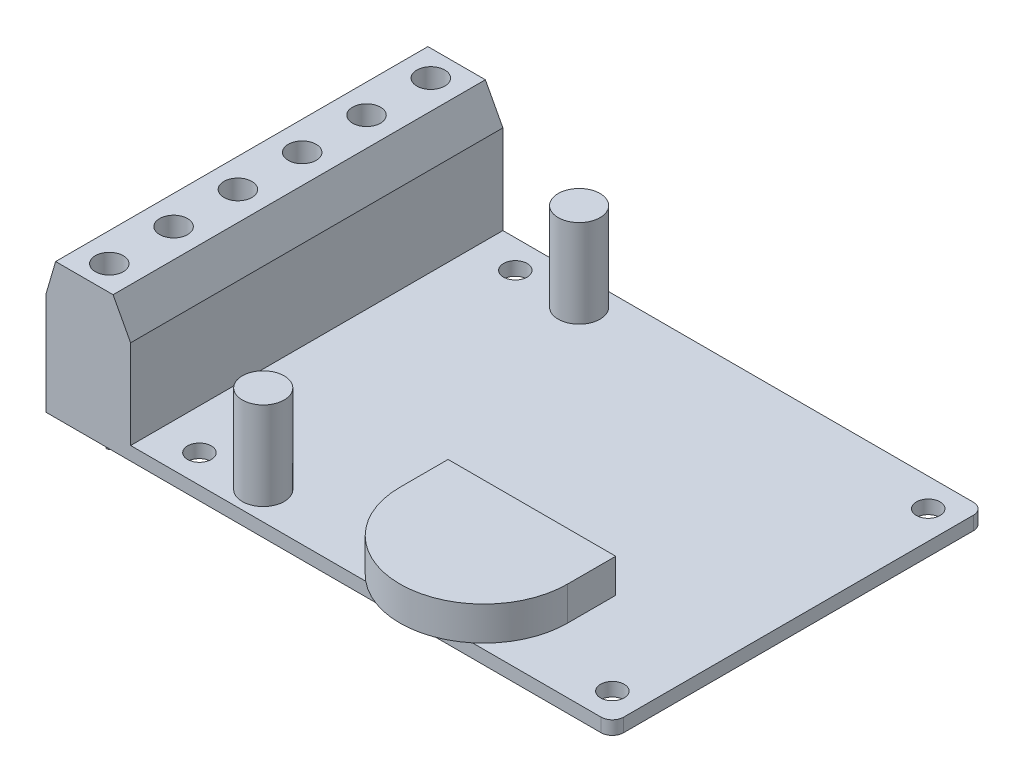
from build123d import *

# Parameters (mm, degrees)
EXTRUDE_1_DEPTH     = 1.2
EXTRUDE_3_DEPTH     = 33
SKETCH_4_R          = 1.237994263
CUT_EXTRUDE_1_DEPTH = 2
SKETCH_5_R          = 1.05
CUT_EXTRUDE_2_DEPTH = 2
SKETCH_6_R          = 0.435075244
EXTRUDE_4_DEPTH     = 0.1
SKETCH_7_R          = 0.221451087
EXTRUDE_5_DEPTH     = 2
SKETCH_8_W          = 0.314102564
SKETCH_8_H          = 2.557692308
EXTRUDE_6_DEPTH     = 0.01
SKETCH_10_R         = 1.85458941
EXTRUDE_7_DEPTH     = 7.8
EXTRUDE_8_DEPTH     = 3


with BuildPart() as part:
    # 草图2 → 凸台-拉伸1 (new body)
    with BuildSketch(Plane(origin=(0, 0, 0), x_dir=(1, 0, 0), z_dir=(0, 1, 0))):
        with BuildLine():
            Line((1, 0), (49.2, 0))
            ThreePointArc((49.2, 0), (49.907106781, -0.292893219), (50.2, -1))
            Line((50.2, -1), (50.2, -32))
            ThreePointArc((50.2, -32), (49.907106781, -32.707106781), (49.2, -33))
            Line((49.2, -33), (1, -33))
            ThreePointArc((1, -33), (0.292893219, -32.707106781), (0, -32))
            Line((0, -32), (0, -1))
            ThreePointArc((0, -1), (0.292893219, -0.292893219), (1, 0))
        make_face()
    extrude(amount=EXTRUDE_1_DEPTH)

    # 草图5 → 切除-拉伸2 (cut)
    with BuildSketch(Plane(origin=(0, 1.2, 0), x_dir=(1, 0, 0), z_dir=(0, 1, 0))):
        with Locations(Location((47.7, -2.5, 0), (0, 0, 270))):
            Circle(SKETCH_5_R)
        with Locations(Location((47.7, -30.5, 0), (0, 0, 270))):
            Circle(SKETCH_5_R)
        with Locations(Location((11.1, -2.5, 0), (0, 0, 270))):
            Circle(SKETCH_5_R)
        with Locations(Location((11.1, -30.5, 0), (0, 0, 270))):
            Circle(SKETCH_5_R)
    extrude(amount=-CUT_EXTRUDE_2_DEPTH, mode=Mode.SUBTRACT)



with BuildPart() as body_2:
    # 草图3 → 凸台-拉伸3 (new body)
    with BuildSketch(Plane.XY):
        Polygon((0, 0), (0, 9.08434782), (0.851677453, 12), (5.945874068, 12), (7.5, 9.08434782), (7.5, 0), align=None)
    extrude(amount=EXTRUDE_3_DEPTH)

    # 草图4 → 切除-拉伸1 (cut)
    with BuildSketch(Plane(origin=(0, 12, 0), x_dir=(1, 0, 0), z_dir=(0, 1, 0))):
        with Locations(Location((3.39877576, -2.288422337, 0), (0, 0, 270))):
            Circle(SKETCH_4_R)
        with Locations(Location((3.39877576, -7.988422337, 0), (0, 0, 270))):
            Circle(SKETCH_4_R)
        with Locations(Location((3.39877576, -13.688422337, 0), (0, 0, 270))):
            Circle(SKETCH_4_R)
        with Locations(Location((3.39877576, -19.388422337, 0), (0, 0, 270))):
            Circle(SKETCH_4_R)
        with Locations(Location((3.39877576, -25.088422337, 0), (0, 0, 270))):
            Circle(SKETCH_4_R)
        with Locations(Location((3.39877576, -30.788422337, 0), (0, 0, 270))):
            Circle(SKETCH_4_R)
    extrude(amount=-CUT_EXTRUDE_1_DEPTH, mode=Mode.SUBTRACT)


with BuildPart() as part_1:
    add(part.part)

    add(body_2.part)  # 凸台-拉伸4 merges body 2
    # 草图6 → 凸台-拉伸4 (add)
    with BuildSketch(Plane.XZ):
        with Locations(Location((3.39877576, 25.088422337, 0), (0, 0, 90))):
            Circle(SKETCH_6_R)
        with Locations(Location((3.39877576, 19.388422337, 0), (0, 0, 90))):
            Circle(SKETCH_6_R)
        with Locations(Location((3.39877576, 13.688422337, 0), (0, 0, 90))):
            Circle(SKETCH_6_R)
        with Locations(Location((3.39877576, 7.988422337, 0), (0, 0, 90))):
            Circle(SKETCH_6_R)
        with Locations(Location((3.39877576, 2.288422337, 0), (0, 0, 90))):
            Circle(SKETCH_6_R)
        with Locations(Location((3.39877576, 30.788422337, 0), (0, 0, 90))):
            Circle(SKETCH_6_R)
    extrude(amount=EXTRUDE_4_DEPTH)

    # 草图7 → 凸台-拉伸5 (add)
    with BuildSketch(Plane.XZ.offset(0.1)):
        with Locations(Location((3.39877576, 30.788422337, 0), (0, 0, 270))):
            Circle(SKETCH_7_R)
        with Locations(Location((3.39877576, 25.088422337, 0), (0, 0, 270))):
            Circle(SKETCH_7_R)
        with Locations(Location((3.39877576, 19.388422337, 0), (0, 0, 270))):
            Circle(SKETCH_7_R)
        with Locations(Location((3.39877576, 13.688422337, 0), (0, 0, 270))):
            Circle(SKETCH_7_R)
        with Locations(Location((3.39877576, 7.988422337, 0), (0, 0, 270))):
            Circle(SKETCH_7_R)
        with Locations(Location((3.39877576, 2.288422337, 0), (0, 0, 270))):
            Circle(SKETCH_7_R)
    extrude(amount=EXTRUDE_5_DEPTH)

    # 草图8 → 凸台-拉伸6 (add)
    # profile 1 of 6: a face of its own
    with BuildSketch(Plane.XZ):
        with BuildLine():
            Line((18.513026826, 20), (19.213447499, 20))
            add(Edge.make_bspline(
                [(19.213447499, 20), (19.260188628, 19.999844414), (19.349936772, 19.999545672), (19.478510043, 19.997879909), (19.59533714, 19.993105553), (19.700356979, 19.98899697), (19.793567634, 19.981505028), (19.875254925, 19.974344381), (19.945042622, 19.96497072), (19.987288473, 19.956265297), (20.006416249, 19.952323718)],
                knots=[0, 0, 0, 0, 1.410062039, 2.707475311, 3.878576406, 4.937260626, 5.877586885, 6.699081471, 7.410979367, 8, 8, 8, 8], degree=3))
            add(Edge.make_bspline(
                [(20.006416249, 19.952323718), (20.032022873, 19.945996953), (20.082689863, 19.933478389), (20.155639929, 19.907018788), (20.225154253, 19.876399163), (20.290944077, 19.840435443), (20.352679868, 19.798860663), (20.410998179, 19.752392541), (20.466163643, 19.701285335), (20.515945273, 19.644250494), (20.562884324, 19.584413984), (20.602472951, 19.519710227), (20.636599431, 19.4520487), (20.663769948, 19.380741282), (20.685647921, 19.30647951), (20.701074161, 19.228590713), (20.710325348, 19.147429738), (20.711267204, 19.09207183), (20.711744775, 19.064002404)],
                knots=[0, 0, 0, 0, 1.027469482, 2.033020251, 3.019912614, 3.986113645, 4.951240523, 5.91722682, 6.890402269, 7.87763091, 8.8651537, 9.85103654, 10.82876324, 11.815024772, 12.821070561, 13.842952187, 14.906261191, 16, 16, 16, 16], degree=3))
            add(Edge.make_bspline(
                [(20.711744775, 19.064002404), (20.710275777, 19.017367299), (20.707409381, 18.926370131), (20.680684277, 18.79430925), (20.636907758, 18.671119935), (20.576584469, 18.556957297), (20.499764993, 18.454046652), (20.407440202, 18.363656197), (20.29955859, 18.288016284), (20.199129274, 18.235563479), (20.110415075, 18.201970571), (20.037381762, 18.178334212), (19.957714784, 18.160072247), (19.87217745, 18.143712115), (19.780413794, 18.13136042), (19.682643755, 18.122313826), (19.578797603, 18.116659777), (19.507458534, 18.115817772), (19.470759198, 18.115384615)],
                knots=[0, 0, 0, 0, 1.260483769, 2.459530307, 3.627416485, 4.787058657, 5.939039949, 7.08810263, 8.267026773, 9.491475466, 10.141966685, 10.831826277, 11.566392101, 12.351337768, 13.187381173, 14.07005841, 15.007169909, 16, 16, 16, 16], degree=3))
            Line((19.470759198, 18.115384615), (20.75661657, 16.5))
            Line((20.75661657, 16.5), (20.368195095, 16.5))
            Line((20.368195095, 16.5), (19.082337724, 18.115384615))
            Line((19.082337724, 18.115384615), (18.82712939, 18.115384615))
            Line((18.82712939, 18.115384615), (18.82712939, 16.5))
            Line((18.82712939, 16.5), (18.513026826, 16.5))
            Line((18.513026826, 16.5), (18.513026826, 20))
        make_face()
        with BuildLine():
            Line((18.82712939, 19.641025641), (18.82712939, 18.474358974))
            Line((18.82712939, 18.474358974), (19.467954711, 18.469451122))
            add(Edge.make_bspline(
                [(19.467954711, 18.469451122), (19.49787475, 18.469437885), (19.555868307, 18.469412229), (19.639768972, 18.473406005), (19.717889083, 18.477949323), (19.789929836, 18.484898669), (19.855923411, 18.49385474), (19.915836824, 18.505057725), (19.969767876, 18.518109787), (20.032666414, 18.538311413), (20.102902946, 18.570317431), (20.179234406, 18.61688293), (20.244236743, 18.675452049), (20.299154606, 18.742425505), (20.343284037, 18.816061754), (20.374396092, 18.895478123), (20.394138534, 18.978669721), (20.396467079, 19.035847829), (20.397642211, 19.064703526)],
                knots=[0, 0, 0, 0, 1.146690395, 2.22261258, 3.21895312, 4.145990853, 4.996080663, 5.770904154, 6.481378293, 7.121626537, 8.300444488, 9.431385265, 10.535395872, 11.636531494, 12.74115979, 13.810798291, 14.895190096, 16, 16, 16, 16], degree=3))
            add(Edge.make_bspline(
                [(20.397642211, 19.064703526), (20.39644009, 19.092850099), (20.394057924, 19.148626338), (20.374609156, 19.230282248), (20.341719775, 19.307349198), (20.297397537, 19.379513683), (20.243398382, 19.445019419), (20.180080569, 19.501066572), (20.109175374, 19.547316037), (20.042904175, 19.576870418), (19.983669963, 19.594990271), (19.932240303, 19.607741435), (19.874128825, 19.617985904), (19.809053367, 19.626193964), (19.737291736, 19.633248909), (19.658481085, 19.638000687), (19.573144304, 19.640814551), (19.513997373, 19.64095364), (19.48337939, 19.641025641)],
                knots=[0, 0, 0, 0, 1.101028733, 2.181837193, 3.264309656, 4.369019818, 5.486613113, 6.575447106, 7.666700264, 8.788928104, 9.402425223, 10.0903467, 10.862060571, 11.710948788, 12.657782767, 13.684531032, 14.801375019, 16, 16, 16, 16], degree=3))
            Line((19.48337939, 19.641025641), (18.82712939, 19.641025641))
        make_face(mode=Mode.SUBTRACT)
    # profile 2 of 6: a face of its own
    with BuildSketch(Plane.XZ):
        with BuildLine():
            Line((21.339949903, 19.057692308), (21.654052467, 19.057692308))
            Line((21.654052467, 19.057692308), (21.654052467, 17.871394231))
            add(Edge.make_bspline(
                [(21.654052467, 17.871394231), (21.654194372, 17.836571482), (21.65446583, 17.769957194), (21.656306771, 17.674102007), (21.660636864, 17.586685294), (21.666050689, 17.507656557), (21.673012825, 17.437029166), (21.681296185, 17.375049809), (21.690554607, 17.321015625), (21.699617321, 17.288472269), (21.703832115, 17.27333734)],
                knots=[0, 0, 0, 0, 1.388932606, 2.656963016, 3.823490214, 4.879454478, 5.816252168, 6.653371382, 7.373723809, 8, 8, 8, 8], degree=3))
            add(Edge.make_bspline(
                [(21.703832115, 17.27333734), (21.71059357, 17.254314469), (21.723975911, 17.216664208), (21.748249395, 17.162275202), (21.778277731, 17.11189992), (21.811137559, 17.063595847), (21.849036967, 17.01879386), (21.891496438, 16.977569617), (21.937094675, 16.938365526), (22.004849698, 16.891980734), (22.097508964, 16.842265403), (22.219161719, 16.799369585), (22.351065945, 16.773733765), (22.442230665, 16.77075951), (22.489088525, 16.769230769)],
                knots=[0, 0, 0, 0, 0.725840625, 1.436591201, 2.137033971, 2.831655856, 3.53531722, 4.242432219, 4.957935707, 5.694543706, 7.190802206, 8.724350549, 10.316345118, 12, 12, 12, 12], degree=3))
            add(Edge.make_bspline(
                [(22.489088525, 16.769230769), (22.535942033, 16.770792018), (22.626594901, 16.773812745), (22.75704987, 16.798596284), (22.876301285, 16.840001973), (22.983152236, 16.897809384), (23.077118076, 16.968551447), (23.155422495, 17.051560256), (23.220029749, 17.144209643), (23.24823917, 17.213333922), (23.262425865, 17.248096955)],
                knots=[0, 0, 0, 0, 1.157059328, 2.238695713, 3.266970494, 4.264342957, 5.228770407, 6.160125903, 7.074715775, 8, 8, 8, 8], degree=3))
            add(Edge.make_bspline(
                [(23.262425865, 17.248096955), (23.266620095, 17.262063254), (23.275892513, 17.292939329), (23.285854865, 17.345319078), (23.294829326, 17.407783682), (23.302492502, 17.480741891), (23.307957665, 17.564003043), (23.310903692, 17.657541119), (23.314231967, 17.76106248), (23.314282483, 17.833530239), (23.314308878, 17.871394231)],
                knots=[0, 0, 0, 0, 0.557542046, 1.232589297, 2.036731608, 2.971723315, 4.038036528, 5.22795436, 6.551621927, 8, 8, 8, 8], degree=3))
            Line((23.314308878, 17.871394231), (23.314308878, 19.057692308))
            Line((23.314308878, 19.057692308), (23.628411442, 19.057692308))
            Line((23.628411442, 19.057692308), (23.628411442, 17.8125))
            add(Edge.make_bspline(
                [(23.628411442, 17.8125), (23.627969747, 17.770192829), (23.627112798, 17.688111129), (23.621605455, 17.568827017), (23.612155842, 17.457664772), (23.597813157, 17.354565552), (23.580947483, 17.259608071), (23.55919121, 17.172670625), (23.533212972, 17.094021071), (23.503907457, 17.022279294), (23.46928559, 16.9572324), (23.432458569, 16.895496583), (23.389933797, 16.838603648), (23.345163563, 16.783721511), (23.295361907, 16.733579983), (23.241462048, 16.687028507), (23.184222628, 16.643355476), (23.12237343, 16.604264196), (23.056817367, 16.569047551), (22.98747351, 16.537831473), (22.913492512, 16.513128896), (22.835828875, 16.49181823), (22.754102096, 16.475103761), (22.668390963, 16.463317194), (22.578724346, 16.456091863), (22.517614887, 16.455454818), (22.486284038, 16.455128205)],
                knots=[0, 0, 0, 0, 1.493040784, 2.896703357, 4.213163133, 5.428574705, 6.569057535, 7.615249723, 8.588095153, 9.490268104, 10.346124644, 11.18633936, 12.024365274, 12.850166724, 13.684164916, 14.514361689, 15.362232829, 16.222528818, 17.093394965, 17.986930858, 18.902426812, 19.842810585, 20.827885679, 21.843828298, 22.894529745, 24, 24, 24, 24], degree=3))
            add(Edge.make_bspline(
                [(22.486284038, 16.455128205), (22.455187524, 16.455467912), (22.394079979, 16.456135468), (22.304408734, 16.463277276), (22.218460128, 16.475085447), (22.13653973, 16.491940664), (22.058565332, 16.512979734), (21.984221092, 16.53798327), (21.914377529, 16.569063751), (21.848195525, 16.604041309), (21.786193137, 16.643606584), (21.728084559, 16.686974624), (21.673947707, 16.734080687), (21.623770639, 16.784728044), (21.578257662, 16.83954498), (21.53684162, 16.898090541), (21.498884915, 16.959784629), (21.464532125, 17.025847792), (21.435020369, 17.098419802), (21.408965123, 17.178716899), (21.387654485, 17.267619415), (21.370312017, 17.365051344), (21.356360576, 17.470546385), (21.346674434, 17.584714801), (21.341258603, 17.707278493), (21.340395542, 17.791928383), (21.339949903, 17.835637019)],
                knots=[0, 0, 0, 0, 1.083640291, 2.129454052, 3.13281866, 4.105697902, 5.042300162, 5.946461698, 6.836384745, 7.703652036, 8.553297018, 9.397182691, 10.228592656, 11.052265423, 11.879314572, 12.708807002, 13.549817954, 14.402308542, 15.300838682, 16.27712199, 17.341985831, 18.484375296, 19.725102775, 21.0496083, 22.476576903, 24, 24, 24, 24], degree=3))
            Line((21.339949903, 17.835637019), (21.339949903, 19.057692308))
        make_face()
    # profile 3 of 6: a face of its own
    with BuildSketch(Plane.XZ):
        with BuildLine():
            add(Edge.make_bspline(
                [(24.457137403, 20.134615385), (24.476628719, 20.133711232), (24.514796459, 20.131940728), (24.569989726, 20.116779251), (24.620246739, 20.091079566), (24.664824471, 20.056599885), (24.703076358, 20.016050441), (24.729857069, 19.968789473), (24.747069465, 19.917730834), (24.74914802, 19.882115745), (24.750206313, 19.863982372)],
                knots=[0, 0, 0, 0, 1.055194115, 2.066272739, 3.074728998, 4.095836921, 5.109056067, 6.073838105, 7.019297344, 8, 8, 8, 8], degree=3))
            add(Edge.make_bspline(
                [(24.750206313, 19.863982372), (24.749124154, 19.846319719), (24.746984852, 19.811402744), (24.729870363, 19.761229272), (24.702848126, 19.714624988), (24.664849, 19.674154278), (24.620240239, 19.639693658), (24.569991453, 19.613988919), (24.514796005, 19.598828782), (24.476628565, 19.597058093), (24.457137403, 19.596153846)],
                knots=[0, 0, 0, 0, 0.96129708, 1.900370562, 2.859976407, 3.87933698, 4.906634145, 5.921202961, 6.938410037, 8, 8, 8, 8], degree=3))
            add(Edge.make_bspline(
                [(24.457137403, 19.596153846), (24.437869128, 19.597023566), (24.400365948, 19.598716363), (24.345999106, 19.614286381), (24.296170616, 19.639702454), (24.251505943, 19.673928639), (24.21427575, 19.714873536), (24.187177425, 19.76120083), (24.170102463, 19.811409985), (24.167957834, 19.846322151), (24.16687298, 19.863982372)],
                knots=[0, 0, 0, 0, 1.054934014, 2.053291228, 3.073705704, 4.106921865, 5.123545215, 6.088680038, 7.033164197, 8, 8, 8, 8], degree=3))
            add(Edge.make_bspline(
                [(24.16687298, 19.863982372), (24.167934067, 19.882113221), (24.170018108, 19.917723354), (24.187190224, 19.968818387), (24.214050032, 20.015799889), (24.251530595, 20.056825388), (24.296164055, 20.091070823), (24.346000801, 20.116481804), (24.4003655, 20.132053144), (24.437868976, 20.133745758), (24.457137403, 20.134615385)],
                knots=[0, 0, 0, 0, 0.98631895, 1.937192651, 2.907499808, 3.917963147, 4.944918757, 5.95915025, 6.951458133, 8, 8, 8, 8], degree=3))
        make_face()
    # profile 4 of 6: a face of its own
    with BuildSketch(Plane.XZ):
        with Locations((24.458539647, 17.778846154)):
            Rectangle(SKETCH_8_W, SKETCH_8_H)
    # profile 5 of 6: a face of its own
    with BuildSketch(Plane.XZ):
        with BuildLine():
            Line((27.622001185, 19.057692308), (27.936103749, 19.057692308))
            Line((27.936103749, 19.057692308), (27.936103749, 17.027944712))
            add(Edge.make_bspline(
                [(27.936103749, 17.027944712), (27.935826707, 16.984707117), (27.935291948, 16.901248144), (27.931440977, 16.780569865), (27.923320299, 16.669103779), (27.914111618, 16.56634152), (27.900864902, 16.47275941), (27.884688534, 16.388078206), (27.866452855, 16.312216643), (27.850432638, 16.265491802), (27.842854551, 16.243389423)],
                knots=[0, 0, 0, 0, 1.307562039, 2.523909702, 3.650326591, 4.686913197, 5.643429486, 6.506965704, 7.293745905, 8, 8, 8, 8], degree=3))
            add(Edge.make_bspline(
                [(27.842854551, 16.243389423), (27.831665312, 16.214659501), (27.809621385, 16.158058664), (27.768335752, 16.077824344), (27.722101848, 16.002277954), (27.669295098, 15.931840503), (27.610154294, 15.86686559), (27.546072802, 15.805941591), (27.47580261, 15.750357423), (27.399383898, 15.701072126), (27.318578265, 15.656685072), (27.233432163, 15.618238505), (27.144425724, 15.584751661), (27.050722833, 15.559668865), (26.953792598, 15.537934145), (26.852495167, 15.523789459), (26.74742237, 15.514162401), (26.67597699, 15.513272168), (26.639729551, 15.512820513)],
                knots=[0, 0, 0, 0, 0.981931301, 1.934503488, 2.87077864, 3.801706999, 4.735015492, 5.667491629, 6.616593066, 7.585388521, 8.561939025, 9.551802639, 10.560317337, 11.588439944, 12.640189604, 13.723962949, 14.845264515, 16, 16, 16, 16], degree=3))
            add(Edge.make_bspline(
                [(26.639729551, 15.512820513), (26.586844816, 15.513676999), (26.483546721, 15.515349946), (26.332941728, 15.534840861), (26.189907008, 15.562395234), (26.056332551, 15.604100661), (25.933062455, 15.655137651), (25.820938579, 15.713732604), (25.720967472, 15.780921913), (25.630843799, 15.857422514), (25.549502208, 15.948386195), (25.472974918, 16.055585039), (25.399313977, 16.180651929), (25.356145339, 16.272444642), (25.333539647, 16.320512821)],
                knots=[0, 0, 0, 0, 1.157897085, 2.2616841, 3.32207898, 4.345638746, 5.321241055, 6.241986252, 7.112515963, 7.955008012, 8.825025602, 9.77857164, 10.836726669, 12, 12, 12, 12], degree=3))
            Line((25.333539647, 16.320512821), (25.647642211, 16.320512821))
            add(Edge.make_bspline(
                [(25.647642211, 16.320512821), (25.67290442, 16.280406945), (25.722288929, 16.202004896), (25.81463741, 16.10049174), (25.915843736, 16.013738376), (26.029323419, 15.943827602), (26.155548634, 15.89111781), (26.294595321, 15.853542514), (26.447594942, 15.831046247), (26.554113157, 15.828334953), (26.609581313, 15.826923077)],
                knots=[0, 0, 0, 0, 0.997731894, 1.950442991, 2.880492273, 3.800895997, 4.748200782, 5.754801363, 6.83083817, 8, 8, 8, 8], degree=3))
            add(Edge.make_bspline(
                [(26.609581313, 15.826923077), (26.664348204, 15.828353226), (26.769933286, 15.831110409), (26.921764455, 15.853552554), (27.060359394, 15.891125987), (27.184919594, 15.943734374), (27.293975363, 16.00818478), (27.387987354, 16.080184855), (27.46413203, 16.161365858), (27.515344997, 16.236147664), (27.547179614, 16.302771793), (27.567451851, 16.360124389), (27.583925821, 16.424977267), (27.597705658, 16.497113003), (27.609076572, 16.57663466), (27.616279454, 16.663724064), (27.621485265, 16.758183286), (27.621825235, 16.823676424), (27.622001185, 16.857572115)],
                knots=[0, 0, 0, 0, 1.570740765, 3.028230971, 4.391408896, 5.680370741, 6.894727393, 8.017376726, 9.065722033, 10.075533815, 10.603371122, 11.180248986, 11.817768598, 12.521299649, 13.286540596, 14.121245857, 15.027658897, 16, 16, 16, 16], degree=3))
            Line((27.622001185, 16.857572115), (27.622001185, 16.990084135))
            add(Edge.make_bspline(
                [(27.622001185, 16.990084135), (27.590120068, 16.952142332), (27.526918612, 16.876926113), (27.417771285, 16.778364476), (27.298554369, 16.693478346), (27.169470827, 16.623859711), (27.033682585, 16.568178287), (26.892660354, 16.529235326), (26.747668299, 16.504075426), (26.649416149, 16.50136811), (26.599765608, 16.5)],
                knots=[0, 0, 0, 0, 1.012485704, 2.007162095, 2.997754123, 3.998611389, 4.999708251, 5.992315798, 6.98544096, 8, 8, 8, 8], degree=3))
            add(Edge.make_bspline(
                [(26.599765608, 16.5), (26.570529339, 16.500515026), (26.512402781, 16.501538985), (26.426048034, 16.510497762), (26.340967596, 16.523496504), (26.257359892, 16.542577943), (26.175104279, 16.56706967), (26.094336687, 16.597686409), (26.01440316, 16.632301527), (25.936756663, 16.67307433), (25.862170532, 16.718436637), (25.791207347, 16.767575528), (25.724238808, 16.820233816), (25.661902318, 16.876930756), (25.604279647, 16.937584289), (25.550595779, 17.001547842), (25.501738432, 17.069714583), (25.456705042, 17.140841541), (25.417647492, 17.215402464), (25.38336312, 17.29178056), (25.353553715, 17.369812514), (25.329788313, 17.449759577), (25.3116372, 17.531571346), (25.298126973, 17.615113795), (25.290464041, 17.700644182), (25.289269117, 17.758265532), (25.288667852, 17.787259615)],
                knots=[0, 0, 0, 0, 1.028754217, 2.045334182, 3.052854819, 4.056607503, 5.061168794, 6.071104265, 7.095078842, 8.125279047, 9.155117945, 10.165957491, 11.161587969, 12.151493252, 13.128948131, 14.104219989, 15.088194871, 16.07871515, 17.064853787, 18.047899887, 19.02414258, 20.002704429, 20.980574569, 21.971845993, 22.979467364, 24, 24, 24, 24], degree=3))
            add(Edge.make_bspline(
                [(25.288667852, 17.787259615), (25.289187018, 17.816262711), (25.29022334, 17.87415657), (25.299174319, 17.960035956), (25.311942509, 18.044765391), (25.332150278, 18.127471533), (25.3564728, 18.209096284), (25.386596373, 18.289036741), (25.422815132, 18.36731725), (25.463824882, 18.443995781), (25.509908974, 18.518043396), (25.560441455, 18.588370042), (25.615483329, 18.654458214), (25.674275245, 18.716974636), (25.737535062, 18.775316129), (25.805230054, 18.829341094), (25.876692935, 18.87995512), (25.952145185, 18.926066457), (26.030422573, 18.966848704), (26.109536391, 19.004061301), (26.190534626, 19.03359542), (26.271907165, 19.059618519), (26.35508708, 19.078053715), (26.439054474, 19.092275957), (26.524096812, 19.100940678), (26.581049707, 19.102022263), (26.609581313, 19.102564103)],
                knots=[0, 0, 0, 0, 1.008818848, 2.013730394, 3.001654427, 3.987803273, 4.973046549, 5.963777569, 6.957074694, 7.972068341, 8.987420212, 9.989399531, 10.982630087, 11.977756091, 12.973280677, 13.973972381, 14.989194003, 16.018387222, 17.047741039, 18.059210846, 19.057554164, 20.045176975, 21.029480261, 22.018708529, 23.007435371, 24, 24, 24, 24], degree=3))
            add(Edge.make_bspline(
                [(26.609581313, 19.102564103), (26.656632252, 19.101207429), (26.7495434, 19.098528416), (26.886274402, 19.077507271), (27.018216642, 19.043993258), (27.146114658, 18.995977627), (27.271010309, 18.930427589), (27.392491964, 18.844084641), (27.510911098, 18.736174301), (27.583988929, 18.653421437), (27.622001185, 18.610376603)],
                knots=[0, 0, 0, 0, 0.96728863, 1.910097829, 2.838038873, 3.762875196, 4.71315279, 5.730631239, 6.819562287, 8, 8, 8, 8], degree=3))
            Line((27.622001185, 18.610376603), (27.622001185, 19.057692308))
        make_face()
        with BuildLine():
            add(Edge.make_bspline(
                [(26.634821698, 18.788461538), (26.588890994, 18.786900473), (26.49795794, 18.783809894), (26.364669597, 18.757425181), (26.235992664, 18.716079281), (26.114387236, 18.656936666), (26.000480126, 18.584842428), (25.899405305, 18.49750214), (25.811000389, 18.397755943), (25.736217451, 18.286505696), (25.676686084, 18.166483421), (25.634542665, 18.039972687), (25.607292642, 17.909017694), (25.60428499, 17.819645091), (25.602770416, 17.774639423)],
                knots=[0, 0, 0, 0, 1.026226791, 2.031711442, 3.026614839, 4.04107745, 5.047145931, 6.032893242, 7.017642609, 8.019221815, 9.021877557, 10.003543541, 10.994637589, 12, 12, 12, 12], degree=3))
            add(Edge.make_bspline(
                [(25.602770416, 17.774639423), (25.603496173, 17.740706151), (25.604923524, 17.673969327), (25.618647102, 17.576031432), (25.640828067, 17.482751118), (25.672265273, 17.394122744), (25.711217968, 17.309637949), (25.760210339, 17.229878714), (25.817861311, 17.154774008), (25.883719649, 17.084879326), (25.956296031, 17.021218358), (26.03501523, 16.965280317), (26.11977048, 16.919529596), (26.20847729, 16.879988759), (26.303288046, 16.851109691), (26.402837132, 16.829070912), (26.507828829, 16.816462154), (26.579400568, 16.814899356), (26.61589141, 16.814102564)],
                knots=[0, 0, 0, 0, 1.039728707, 2.044842319, 3.024901384, 3.974314358, 4.923051295, 5.871625912, 6.837440708, 7.820715446, 8.810779094, 9.792721783, 10.773906224, 11.758876063, 12.764959493, 13.806266761, 14.881525401, 16, 16, 16, 16], degree=3))
            add(Edge.make_bspline(
                [(26.61589141, 16.814102564), (26.652855168, 16.814870173), (26.725137405, 16.816371224), (26.830708342, 16.829274723), (26.930741082, 16.850096699), (27.025143904, 16.879659725), (27.114273245, 16.917381475), (27.19712786, 16.965118093), (27.275484308, 17.019482525), (27.346840718, 17.082894539), (27.411364883, 17.152779534), (27.46759565, 17.228824429), (27.515510099, 17.309884948), (27.555187769, 17.395951954), (27.585478973, 17.487694307), (27.605797878, 17.584882663), (27.620004623, 17.687051401), (27.621325548, 17.757060018), (27.622001185, 17.79286859)],
                knots=[0, 0, 0, 0, 1.121943988, 2.193949579, 3.223793937, 4.220241907, 5.192961521, 6.155822191, 7.11847367, 8.083710714, 9.04790392, 10.001595906, 10.949595423, 11.902125208, 12.873731292, 13.87582262, 14.913508608, 16, 16, 16, 16], degree=3))
            add(Edge.make_bspline(
                [(27.622001185, 17.79286859), (27.620661617, 17.839486444), (27.618044572, 17.930561349), (27.593347414, 18.063268117), (27.553527204, 18.18803679), (27.497680451, 18.304472766), (27.427698443, 18.411342316), (27.343407594, 18.506666161), (27.246261563, 18.590567017), (27.136539463, 18.660465211), (27.018492018, 18.716930645), (26.894970822, 18.759292417), (26.766159258, 18.783286732), (26.678852848, 18.786726675), (26.634821698, 18.788461538)],
                knots=[0, 0, 0, 0, 1.070913519, 2.092188694, 3.091357305, 4.074328408, 5.051968682, 6.018948707, 6.99050112, 7.9935919, 9.000589572, 9.992915277, 10.987769056, 12, 12, 12, 12], degree=3))
        make_face(mode=Mode.SUBTRACT)
    # profile 6 of 6: a face of its own
    with BuildSketch(Plane.XZ):
        with BuildLine():
            Line((30.753211121, 17.307692308), (31.032257595, 17.161157853))
            add(Edge.make_bspline(
                [(31.032257595, 17.161157853), (31.010021, 17.121714521), (30.966757392, 17.044973418), (30.892356644, 16.939541558), (30.814364571, 16.844693842), (30.729260603, 16.762964188), (30.639590924, 16.691712803), (30.54485827, 16.629374978), (30.444569452, 16.576256458), (30.338719727, 16.53150393), (30.226420176, 16.497094436), (30.107398659, 16.472790215), (29.981427164, 16.457766946), (29.895080984, 16.456021806), (29.850867371, 16.455128205)],
                knots=[0, 0, 0, 0, 1.120438281, 2.179929193, 3.190490725, 4.156257408, 5.095198341, 6.022838206, 6.959905092, 7.901321166, 8.864066838, 9.862729781, 10.905609505, 12, 12, 12, 12], degree=3))
            add(Edge.make_bspline(
                [(29.850867371, 16.455128205), (29.801725394, 16.45627538), (29.705863632, 16.458513187), (29.566323885, 16.477805652), (29.434944466, 16.50927801), (29.311732763, 16.553243552), (29.19699051, 16.610670876), (29.090489656, 16.680630358), (28.99167013, 16.762762612), (28.903645921, 16.857779056), (28.824402038, 16.959461013), (28.754476218, 17.065416898), (28.696018787, 17.175380122), (28.648466177, 17.288650646), (28.610061312, 17.40451454), (28.583294608, 17.524026007), (28.56786486, 17.646861592), (28.565500414, 17.729958927), (28.564308878, 17.771834936)],
                knots=[0, 0, 0, 0, 1.145258523, 2.234067595, 3.276747158, 4.290159414, 5.277019952, 6.260822364, 7.254936242, 8.264827045, 9.274100331, 10.257902744, 11.220704747, 12.172965371, 13.118907548, 14.062713208, 15.023725156, 16, 16, 16, 16], degree=3))
            add(Edge.make_bspline(
                [(28.564308878, 17.771834936), (28.565368019, 17.811129766), (28.567467097, 17.889006931), (28.580697885, 18.004272476), (28.604146178, 18.116300928), (28.636322502, 18.225185376), (28.677873748, 18.33074351), (28.728705967, 18.433039574), (28.788898345, 18.531964713), (28.835371018, 18.594367847), (28.858780031, 18.625801282)],
                knots=[0, 0, 0, 0, 1.024358464, 2.0301432, 3.019427413, 4.004406732, 4.986367066, 5.972626655, 6.978780325, 8, 8, 8, 8], degree=3))
            add(Edge.make_bspline(
                [(28.858780031, 18.625801282), (28.890487714, 18.663670152), (28.952898661, 18.738208303), (29.058455016, 18.836146628), (29.172755212, 18.918190404), (29.294366839, 18.98619754), (29.424703313, 19.037871187), (29.562012604, 19.076378769), (29.70785819, 19.09795678), (29.807563411, 19.101004614), (29.858579711, 19.102564103)],
                knots=[0, 0, 0, 0, 1.030682036, 2.02871468, 2.997146059, 3.962720338, 4.930598197, 5.918074684, 6.934738563, 8, 8, 8, 8], degree=3))
            add(Edge.make_bspline(
                [(29.858579711, 19.102564103), (29.911027316, 19.101210054), (30.013917562, 19.098553718), (30.163949683, 19.073927385), (30.3059104, 19.03487483), (30.439742904, 18.97972104), (30.565460765, 18.908561488), (30.682246814, 18.820419647), (30.792098327, 18.718001559), (30.856006906, 18.63923835), (30.888527628, 18.599158654)],
                knots=[0, 0, 0, 0, 1.056321875, 2.072262726, 3.055038591, 4.01806755, 4.982017516, 5.957941055, 6.960871419, 8, 8, 8, 8], degree=3))
            add(Edge.make_bspline(
                [(30.888527628, 18.599158654), (30.910654566, 18.568955072), (30.954761159, 18.508748954), (31.010008259, 18.410577797), (31.057965654, 18.307867202), (31.096298615, 18.198956905), (31.127338116, 18.085137325), (31.149794935, 17.96559478), (31.162964554, 17.840364869), (31.165553251, 17.755038314), (31.16687298, 17.711538462)],
                knots=[0, 0, 0, 0, 0.94817472, 1.890038105, 2.849395472, 3.817997239, 4.812318967, 5.836947057, 6.897266129, 8, 8, 8, 8], degree=3))
            Line((31.16687298, 17.711538462), (28.878411442, 17.711538462))
            add(Edge.make_bspline(
                [(28.878411442, 17.711538462), (28.879951048, 17.677837997), (28.882978622, 17.611567394), (28.897093765, 17.51459661), (28.919342539, 17.422223268), (28.950611602, 17.335140226), (28.988478447, 17.252210099), (29.034864164, 17.174048062), (29.090203718, 17.101010132), (29.151929417, 17.032442994), (29.220636512, 16.971382233), (29.29291926, 16.916730457), (29.369812825, 16.87092486), (29.450710908, 16.83374497), (29.535482693, 16.804638654), (29.624154888, 16.784770834), (29.716553005, 16.771463727), (29.779538739, 16.769984061), (29.811604551, 16.769230769)],
                knots=[0, 0, 0, 0, 1.094153842, 2.151609401, 3.174256925, 4.172055639, 5.149267565, 6.128595816, 7.11444997, 8.118368179, 9.117203808, 10.09244225, 11.054858984, 12.015122123, 12.976791628, 13.957293641, 14.960065497, 16, 16, 16, 16], degree=3))
            add(Edge.make_bspline(
                [(29.811604551, 16.769230769), (29.842955698, 16.769838826), (29.905162389, 16.771045327), (29.997803246, 16.782777238), (30.088942774, 16.801747513), (30.178203757, 16.827637504), (30.263774603, 16.859214356), (30.343020153, 16.897317213), (30.415900369, 16.93946696), (30.484017335, 16.987676635), (30.550088329, 17.046684822), (30.615630815, 17.120320543), (30.685907468, 17.207408071), (30.729897061, 17.272953737), (30.753211121, 17.307692308)],
                knots=[0, 0, 0, 0, 0.99110716, 1.966546729, 2.947904876, 3.932708344, 4.903319531, 5.828989031, 6.710028674, 7.56322171, 8.463672341, 9.504779593, 10.677557249, 12, 12, 12, 12], degree=3))
        make_face()
        with BuildLine():
            add(Edge.make_bspline(
                [(30.852770416, 18.025641026), (30.841273791, 18.067303899), (30.81914649, 18.14749152), (30.772910126, 18.25853241), (30.720838585, 18.357220311), (30.659216853, 18.442799944), (30.589398128, 18.518803457), (30.508752945, 18.585222043), (30.418317052, 18.644639494), (30.318557911, 18.694791993), (30.212916126, 18.737481852), (30.102309934, 18.766106968), (29.989452146, 18.78571651), (29.91311786, 18.787542618), (29.874705512, 18.788461538)],
                knots=[0, 0, 0, 0, 1.154881502, 2.222775134, 3.210006277, 4.132804581, 5.035138423, 5.962687519, 6.919655026, 7.923214229, 8.944639381, 9.960483929, 10.97369054, 12, 12, 12, 12], degree=3))
            add(Edge.make_bspline(
                [(29.874705512, 18.788461538), (29.843356074, 18.787849867), (29.781384825, 18.786640721), (29.690083756, 18.775170592), (29.602404057, 18.756210747), (29.51769877, 18.73024579), (29.437077901, 18.695637188), (29.358883133, 18.655053961), (29.285102737, 18.605512377), (29.238961442, 18.567753522), (29.215651025, 18.548677885)],
                knots=[0, 0, 0, 0, 1.04873581, 2.073130211, 3.073294108, 4.04793562, 5.032784715, 6.005352987, 6.992311501, 8, 8, 8, 8], degree=3))
            add(Edge.make_bspline(
                [(29.215651025, 18.548677885), (29.198957743, 18.533583569), (29.165174609, 18.503036353), (29.120034087, 18.450407146), (29.076813615, 18.393655584), (29.037479962, 18.33061046), (29.001402375, 18.261989681), (28.967642398, 18.188372045), (28.937255986, 18.109198915), (28.920159876, 18.054026476), (28.911364166, 18.025641026)],
                knots=[0, 0, 0, 0, 0.879870761, 1.780643979, 2.707998968, 3.669668524, 4.684282772, 5.740141944, 6.837334558, 8, 8, 8, 8], degree=3))
            Line((28.911364166, 18.025641026), (30.852770416, 18.025641026))
        make_face(mode=Mode.SUBTRACT)
    extrude(amount=EXTRUDE_6_DEPTH)

    # 草图10 → 凸台-拉伸7 (add)
    with BuildSketch(Plane(origin=(0, 1.2, 0), x_dir=(1, 0, 0), z_dir=(0, 1, 0))):
        with Locations(Location((16.755343087, -2.5, 0), (0, 0, 270))):
            Circle(SKETCH_10_R)
        with Locations(Location((16.755343087, -30.5, 0), (0, 0, 90))):
            Circle(SKETCH_10_R)
    extrude(amount=EXTRUDE_7_DEPTH)

    # 草图11 → 凸台-拉伸8 (add)
    with BuildSketch(Plane(origin=(0, 1.2, 0), x_dir=(1, 0, 0), z_dir=(0, 1, 0))):
        with BuildLine():
            Line((25.64, -23), (40.5, -23))
            Line((40.5, -23), (40.5, -27.27))
            ThreePointArc((40.5, -27.27), (33.07, -34.7), (25.64, -27.27))
            Line((25.64, -27.27), (25.64, -23))
        make_face()
    extrude(amount=EXTRUDE_8_DEPTH)


solid = part_1.part
